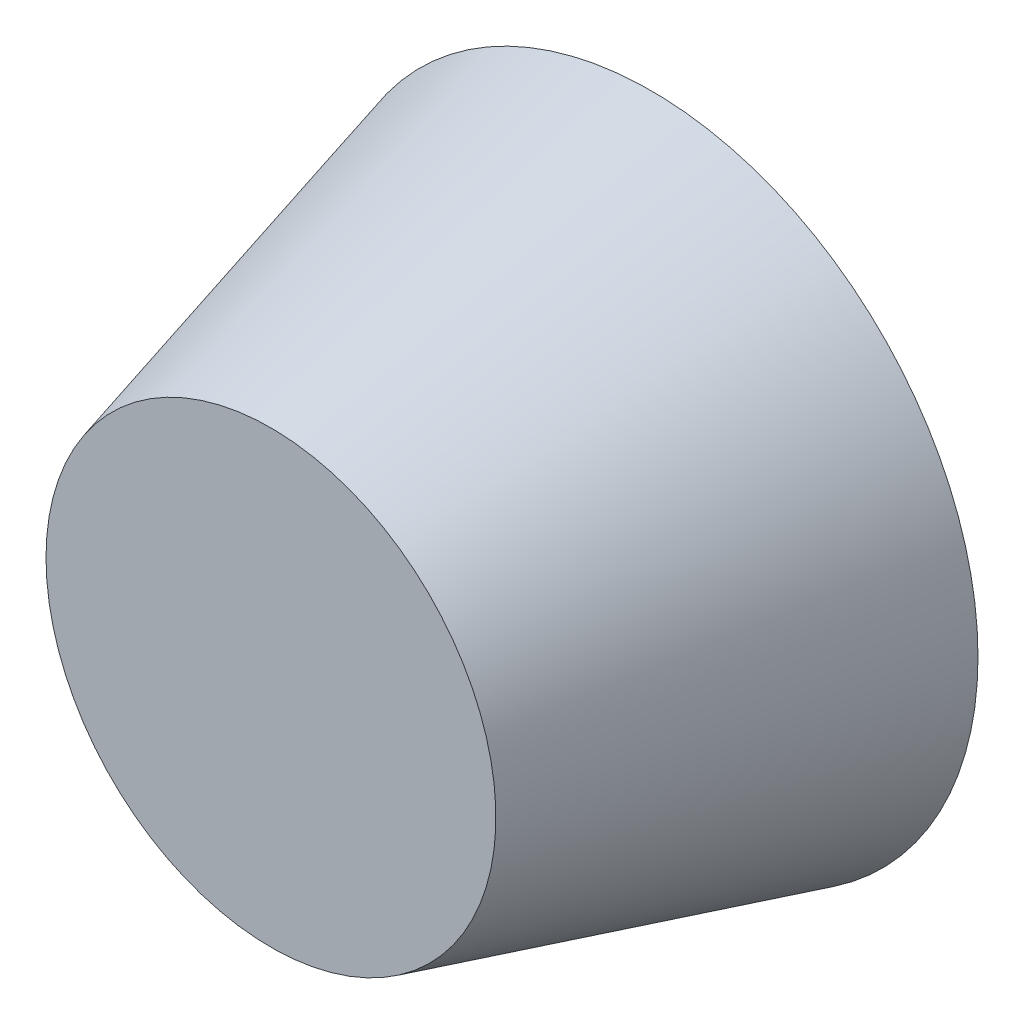
from build123d import *


with BuildPart() as part:
    # Sketch1 → Revolve1 (revolve)
    with BuildSketch(Plane(origin=(0, 0, 0), x_dir=(1, 0, 0), z_dir=(0, 1, 0)), mode=Mode.PRIVATE) as revolve1_sk:
        Polygon((0, 0), (40, 0), (58.117333157, 67.61480784), (55.117333157, 67.61480784), (37.803847577, 3), (0, 3), align=None)
    revolve(revolve1_sk.sketch.rotate(Axis((0, 0, -3), (0, 0, 1)), 180), axis=Axis((0, 0, -3), (0, 0, 1)))


solid = part.part
